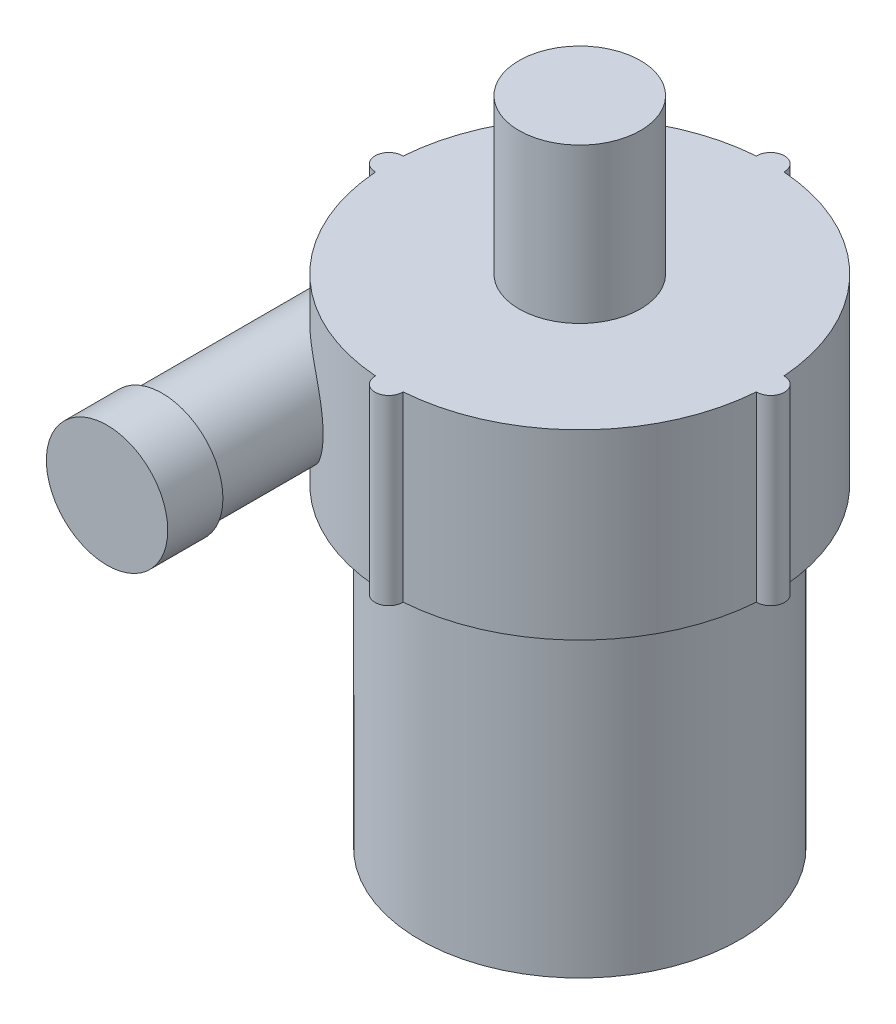
from build123d import *

# Parameters (mm, degrees)
SKETCH1_R           = 29
BOSS_EXTRUDE1_DEPTH = 90
SKETCH2_R           = 11
BOSS_EXTRUDE2_DEPTH = 28
SKETCH3_R           = 34.6
BOSS_EXTRUDE3_DEPTH = 33
SKETCH4_R           = 2.5
BOSS_EXTRUDE4_DEPTH = 33
SKETCH5_R           = 10
BOSS_EXTRUDE5_DEPTH = 60
SKETCH6_R           = 11
BOSS_EXTRUDE6_DEPTH = 10


with BuildPart() as part:
    # Sketch1 → Boss-Extrude1 (new body)
    with BuildSketch(Plane(origin=(0, 0, 0), x_dir=(1, 0, 0), z_dir=(0, 1, 0))):
        with Locations(Location((0, 0, 0), (0, 0, 90))):
            Circle(SKETCH1_R)
    extrude(amount=BOSS_EXTRUDE1_DEPTH)

    # Sketch2 → Boss-Extrude2 (add)
    with BuildSketch(Plane(origin=(0, 90, 0), x_dir=(1, 0, 0), z_dir=(0, 1, 0))):
        with Locations(Location((0, 0, 0), (0, 0, 270))):
            Circle(SKETCH2_R)
    extrude(amount=BOSS_EXTRUDE2_DEPTH)

    # Sketch3 → Boss-Extrude3 (add)
    with BuildSketch(Plane(origin=(0, 90, 0), x_dir=(1, 0, 0), z_dir=(0, 1, 0))):
        with Locations(Location((0, 0, 0), (0, 0, 270))):
            Circle(SKETCH3_R)
    extrude(amount=-BOSS_EXTRUDE3_DEPTH)

    # Sketch4 → Boss-Extrude4 (add)
    with BuildSketch(Plane(origin=(0, 90, 0), x_dir=(1, 0, 0), z_dir=(0, 1, 0))):
        with Locations((0, 34.6)):
            Circle(SKETCH4_R)
        with Locations((-34.6, 0)):
            Circle(SKETCH4_R)
        with Locations((0, -34.6)):
            Circle(SKETCH4_R)
        with Locations((34.6, 0)):
            Circle(SKETCH4_R)
    extrude(amount=-BOSS_EXTRUDE4_DEPTH)

    # Sketch5 → Boss-Extrude5 (add)
    with BuildSketch(Plane.XY):
        with Locations(Location((-25.665087219, 72.446676229, 0), (0, 0, 207.814921286))):
            Circle(SKETCH5_R)
    extrude(amount=BOSS_EXTRUDE5_DEPTH)

    # Sketch6 → Boss-Extrude6 (add)
    with BuildSketch(Plane.XY.offset(60)):
        with Locations((-25.665087219, 72.446676229)):
            Circle(SKETCH6_R)
    extrude(amount=-BOSS_EXTRUDE6_DEPTH)


solid = part.part
